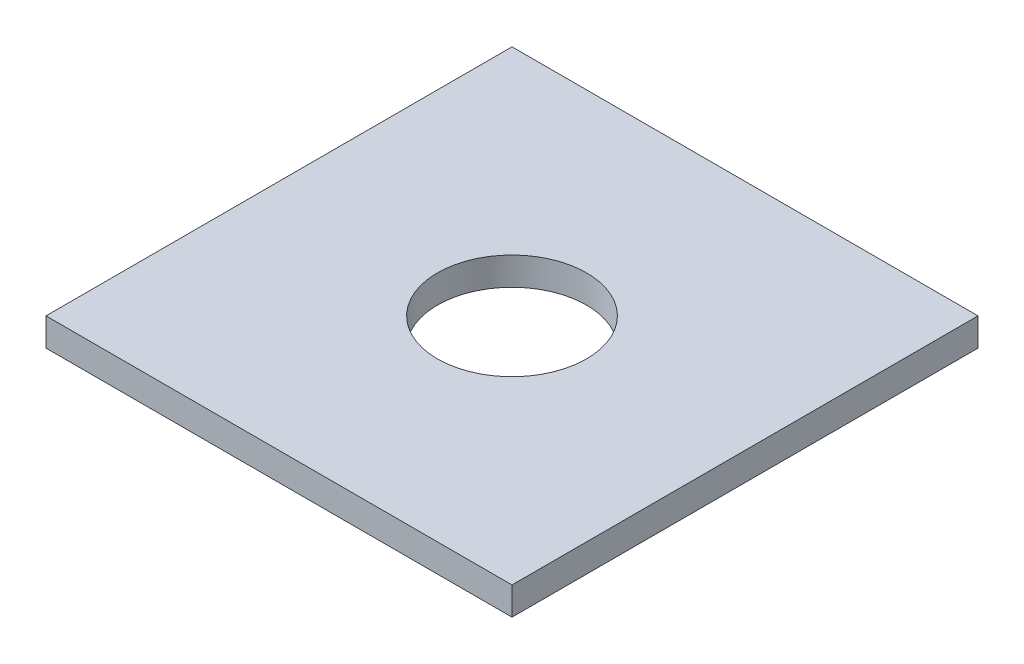
from build123d import *

# Parameters (mm, degrees)
SKIZZE1_W                       = 50
SKIZZE1_H                       = 50
SKIZZE1_R                       = 8
AUFSATZ_LINEAR_AUSTRAGEN1_DEPTH = 3


with BuildPart() as part:
    # Skizze1 → Aufsatz-Linear austragen1 (new body)
    with BuildSketch(Plane(origin=(0, 0, 0), x_dir=(1, 0, 0), z_dir=(0, 1, 0))):
        Rectangle(SKIZZE1_W, SKIZZE1_H)
        Circle(SKIZZE1_R, mode=Mode.SUBTRACT)
    extrude(amount=AUFSATZ_LINEAR_AUSTRAGEN1_DEPTH)


solid = part.part
